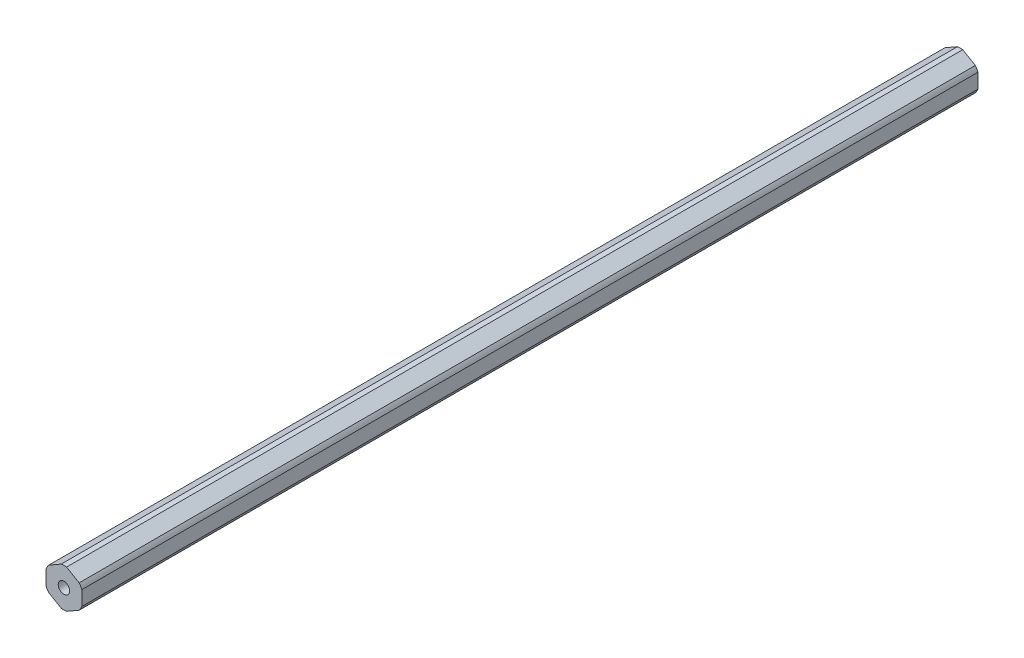
from build123d import *

# Parameters (mm, degrees)
BOSS_EXTRUDE1_DEPTH                  = 158.8516
F_10_32_TAPPED_HOLE1_D               = 4.0386
F_10_32_TAPPED_HOLE1_DEPTH           = 12.02944
F_10_32_TAPPED_HOLE1_TIP             = 1.213317848
F_10_32_TAPPED_HOLE1_ON_FACE_2_D     = 4.0386
F_10_32_TAPPED_HOLE1_ON_FACE_2_DEPTH = 12.02944
F_10_32_TAPPED_HOLE1_ON_FACE_2_TIP   = 1.213317848


with BuildPart() as part:
    # Sketch1 → Boss-Extrude1 (new, symmetric)
    with BuildSketch(Plane.XY):
        with BuildLine():
            ThreePointArc((6.35, 2.590301913), (5.939202219, 3.429), (5.41826726, 4.204110358))
            Line((5.41826726, 4.204110358), (0.93173274, 6.79441227))
            ThreePointArc((0.93173274, 6.79441227), (0, 6.858), (-0.93173274, 6.79441227))
            Line((-0.93173274, 6.79441227), (-5.41826726, 4.204110358))
            ThreePointArc((-5.41826726, 4.204110358), (-5.939202219, 3.429), (-6.35, 2.590301913))
            Line((-6.35, 2.590301913), (-6.35, -2.590301913))
            ThreePointArc((-6.35, -2.590301913), (-5.939202219, -3.429), (-5.41826726, -4.204110358))
            Line((-5.41826726, -4.204110358), (-0.93173274, -6.79441227))
            ThreePointArc((-0.93173274, -6.79441227), (0, -6.858), (0.93173274, -6.79441227))
            Line((0.93173274, -6.79441227), (5.41826726, -4.204110358))
            ThreePointArc((5.41826726, -4.204110358), (5.939202219, -3.429), (6.35, -2.590301913))
            Line((6.35, -2.590301913), (6.35, 2.590301913))
        make_face()
    extrude(amount=BOSS_EXTRUDE1_DEPTH, both=True)

    # #10-32 Tapped Hole1
    with Locations(Plane(origin=(0, 0, -158.8516), x_dir=(-1, 0, 0), z_dir=(0, 0, -1))):
        with Locations((0, 0)):
            Hole(F_10_32_TAPPED_HOLE1_D / 2, depth=F_10_32_TAPPED_HOLE1_DEPTH)
            with Locations((0, 0, -(F_10_32_TAPPED_HOLE1_DEPTH + F_10_32_TAPPED_HOLE1_TIP / 2))):  # 118° drill point
                Cone(0, F_10_32_TAPPED_HOLE1_D / 2, F_10_32_TAPPED_HOLE1_TIP, mode=Mode.SUBTRACT)

    # #10-32 Tapped Hole1 on face 2
    with Locations(Plane.XY.offset(158.8516)):
        with Locations((0, 0)):
            Hole(F_10_32_TAPPED_HOLE1_ON_FACE_2_D / 2, depth=F_10_32_TAPPED_HOLE1_ON_FACE_2_DEPTH)
            with Locations((0, 0, -(F_10_32_TAPPED_HOLE1_ON_FACE_2_DEPTH + F_10_32_TAPPED_HOLE1_ON_FACE_2_TIP / 2))):  # 118° drill point
                Cone(0, F_10_32_TAPPED_HOLE1_ON_FACE_2_D / 2, F_10_32_TAPPED_HOLE1_ON_FACE_2_TIP, mode=Mode.SUBTRACT)


solid = part.part
